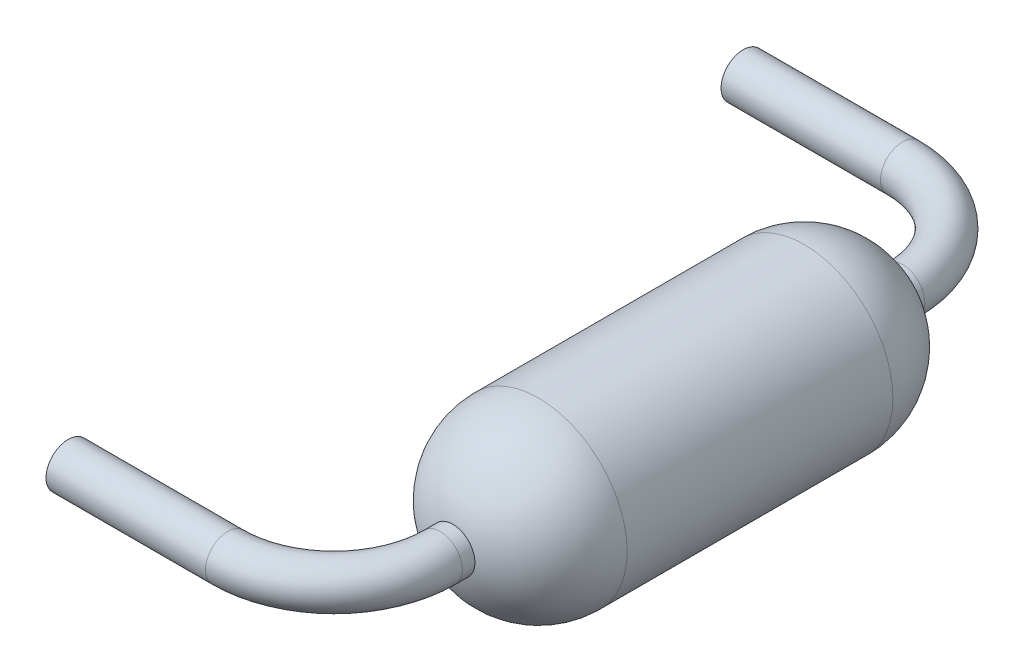
from build123d import *

# Parameters (mm, degrees)
SKETCH1_R           = 1
BOSS_EXTRUDE1_DEPTH = 1.5
DOME1_FACE_RADIUS   = 1
DOME1_HEIGHT        = 1
DOME2_FACE_RADIUS   = 1
DOME2_HEIGHT        = 1
SKETCH4_R           = 0.25


with BuildPart() as part:
    # Sketch1 → Boss-Extrude1 (new, symmetric)
    with BuildSketch(Plane.XY):
        Circle(SKETCH1_R)
    extrude(amount=BOSS_EXTRUDE1_DEPTH, both=True)

    # Dome1: a dome of height H over a round flat face of radius A is a cap of a sphere of radius (A * A + H * H) / (2 * H)
    dome1_r = (DOME1_FACE_RADIUS * DOME1_FACE_RADIUS + DOME1_HEIGHT * DOME1_HEIGHT) / (2 * DOME1_HEIGHT)
    dome1_base = Plane((0, 0, 1.5), z_dir=(0, 0, 1))
    with Locations(dome1_base.offset(DOME1_HEIGHT - dome1_r)):
        dome1_ball = Sphere(dome1_r, mode=Mode.PRIVATE)
    add(split(dome1_ball, bisect_by=dome1_base, keep=Keep.TOP, mode=Mode.PRIVATE))

    # Dome2: a dome of height H over a round flat face of radius A is a cap of a sphere of radius (A * A + H * H) / (2 * H)
    dome2_r = (DOME2_FACE_RADIUS * DOME2_FACE_RADIUS + DOME2_HEIGHT * DOME2_HEIGHT) / (2 * DOME2_HEIGHT)
    dome2_base = Plane((0, 0, -1.5), z_dir=(0, 0, -1))
    with Locations(dome2_base.offset(DOME2_HEIGHT - dome2_r)):
        dome2_ball = Sphere(dome2_r, mode=Mode.PRIVATE)
    add(split(dome2_ball, bisect_by=dome2_base, keep=Keep.TOP, mode=Mode.PRIVATE))

    # Sweep1: sweep along a path in Sketch3
    with BuildLine(Plane(origin=(0, 0, 0), x_dir=(1, 0, 0), z_dir=(0, 1, 0))) as sweep1_path:
        Line((-3, -3.81), (-1.2, -3.81))
        ThreePointArc((-1.2, -3.81), (-0.351471863, -3.458528137), (0, -2.61))
        Line((0, -2.61), (0, 2.61))
        ThreePointArc((0, 2.61), (-0.351471863, 3.458528137), (-1.2, 3.81))
        Line((-1.2, 3.81), (-3, 3.81))
    # Sketch4 → Sweep1 (sweep)
    with BuildSketch(Plane.XY):
        Circle(SKETCH4_R)
    sweep(path=sweep1_path.line)


solid = part.part
